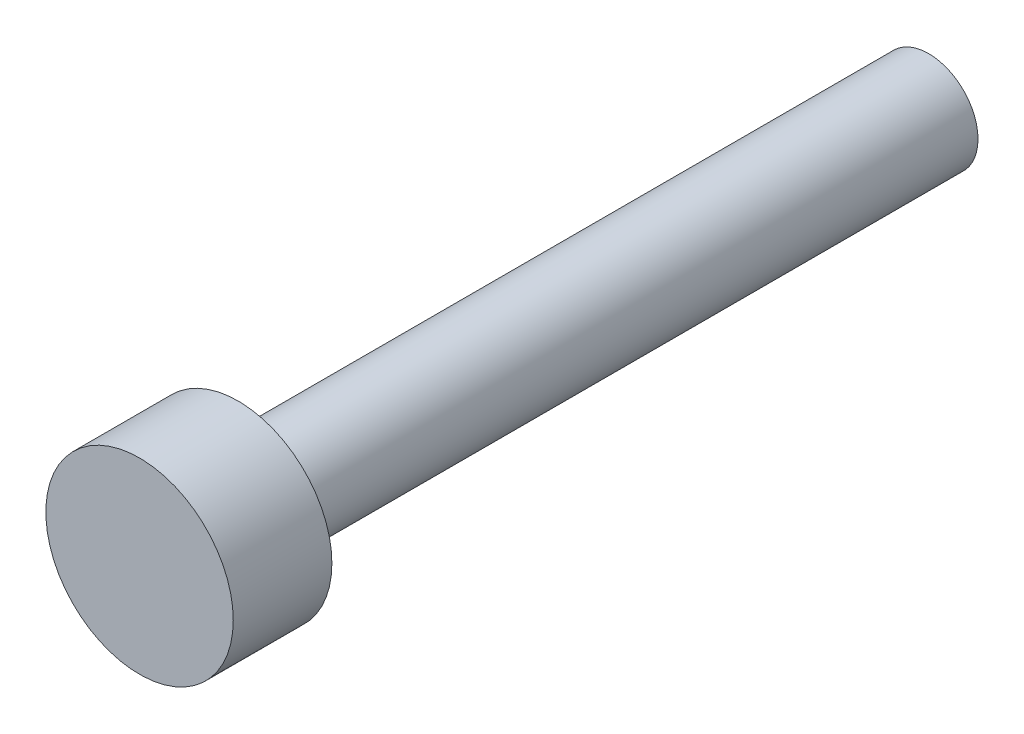
from build123d import *

# Parameters (mm, degrees)
THREAD_ENVELOPE_START = -14
SKETCH1_R             = 1
THREAD_ENVELOPE_DEPTH = 14
SKETCH2_R             = 1.9
HEAD_ENVELOPE_DEPTH   = 2


with BuildPart() as part:
    # Sketch1 → Thread_Envelope (new body)
    with BuildSketch(Plane.XY.offset(THREAD_ENVELOPE_START)):
        Circle(SKETCH1_R)
    extrude(amount=THREAD_ENVELOPE_DEPTH)

    # Sketch2 → Head_Envelope (add)
    with BuildSketch(Plane.XY):
        Circle(SKETCH2_R)
    extrude(amount=HEAD_ENVELOPE_DEPTH)


solid = part.part
